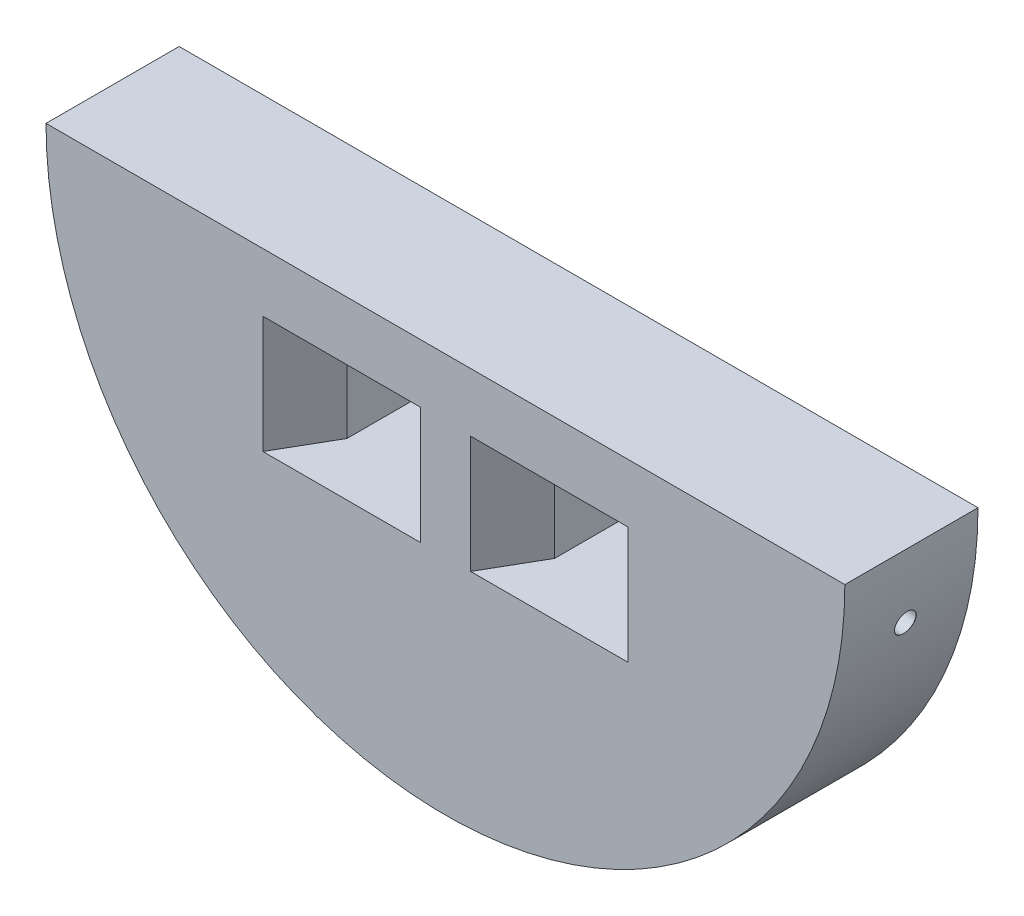
from build123d import *
from OCP.BRepFilletAPI import BRepFilletAPI_MakeChamfer

# Parameters (mm, degrees)
SKETCH1_W           = 18
SKETCH1_H           = 18
BOSS_EXTRUDE1_DEPTH = 25
CIRPATTERN1_COUNT   = 5
CIRPATTERN1_ANGLE   = 160
CHAMFER1_SIZE       = 15
CHAMFER1_SIZE2      = 8.660254038
CHAMFER3_SIZE       = 10
CHAMFER3_SIZE2      = 5.773502692
CHAMFER4_SIZE       = 4
CHAMFER4_SIZE2      = 6.92820323


with BuildPart() as part:
    # Sketch1 → Boss-Extrude1 (new body)
    with BuildSketch(Plane.XY):
        with BuildLine():
            Line((-150, 0), (0, 0))
            ThreePointArc((0, 0), (-75, -75), (-150, 0))
        make_face()
        with Locations((-55.5, -24)):
            Rectangle(SKETCH1_W, SKETCH1_H, mode=Mode.SUBTRACT)
        with Locations((-94.5, -24)):
            Rectangle(SKETCH1_W, SKETCH1_H, mode=Mode.SUBTRACT)
    extrude(amount=BOSS_EXTRUDE1_DEPTH)

    # Sketch4 → Ø4.0mm Dowel Hole2 (revolve, cut)
    with BuildSketch(Plane(origin=(-1.139418524, -13.023613325, 12.5), x_dir=(0.17364817766693047, 0.9848077530122081, 0), z_dir=(0, 0, 1))):
        Polygon((0, 0), (0, 17.201721238), (2, 16), (2, 0.025), (2.025, 0), align=None)
    f_4_0mm_dowel_hole2 = revolve(axis=Axis((5.114110708, -14.126279253, 12.5), (-0.9848077530122081, 0.17364817766693044, 0)), mode=Mode.SUBTRACT)

    # CirPattern1: Ø4.0mm Dowel Hole2 ×5 about axis
    cirpattern1_axis = Axis((-75, 0, 0), (0, 0, -1))
    for i in range(1, CIRPATTERN1_COUNT):
        add(f_4_0mm_dowel_hole2.rotate(cirpattern1_axis, i * CIRPATTERN1_ANGLE / (CIRPATTERN1_COUNT - 1)), mode=Mode.SUBTRACT)

    # Chamfer1: one chamfer whose edges measure the first distance from different faces: ONE call of the kernel's chamfer builder (chamfer() names one face for all edges)
    chamfer1_edges_1 = [part.edges().sort_by_distance(p)[0] for p in [
        (-55.5, -15, 0),
    ]]
    chamfer1_side_1 = [part.faces().sort_by_distance(p)[0] for p in [
        (-55.5, -15, 12.5),
    ]]
    chamfer1_edges_2 = [part.edges().sort_by_distance(p)[0] for p in [
        (-94.5, -15, 0),
    ]]
    chamfer1_side_2 = [part.faces().sort_by_distance(p)[0] for p in [
        (-94.5, -15, 12.5),
    ]]
    chamfer1 = BRepFilletAPI_MakeChamfer(part.part.solid().wrapped)
    for e in chamfer1_edges_1:
        chamfer1.Add(CHAMFER1_SIZE, CHAMFER1_SIZE2, e.wrapped, chamfer1_side_1[0].wrapped)  # the first distance lies on this face
    for e in chamfer1_edges_2:
        chamfer1.Add(CHAMFER1_SIZE, CHAMFER1_SIZE2, e.wrapped, chamfer1_side_2[0].wrapped)  # the first distance lies on this face
    add(Compound.cast(chamfer1.Shape()), mode=Mode.REPLACE)

    # Chamfer3: one chamfer whose edges measure the first distance from different faces: ONE call of the kernel's chamfer builder (chamfer() names one face for all edges)
    chamfer3_edges_1 = [part.edges().sort_by_distance(p)[0] for p in [
        (-103.5, -24, 25),
    ]]
    chamfer3_side_1 = [part.faces().sort_by_distance(p)[0] for p in [
        (-103.5, -22.500700474, 11.554010123),
    ]]
    chamfer3_edges_2 = [part.edges().sort_by_distance(p)[0] for p in [
        (-85.5, -24, 25),
    ]]
    chamfer3_side_2 = [part.faces().sort_by_distance(p)[0] for p in [
        (-85.5, -22.500700474, 11.554010123),
    ]]
    chamfer3_edges_3 = [part.edges().sort_by_distance(p)[0] for p in [
        (-46.5, -24, 25),
    ]]
    chamfer3_side_3 = [part.faces().sort_by_distance(p)[0] for p in [
        (-46.5, -22.500700474, 11.554010123),
    ]]
    chamfer3_edges_4 = [part.edges().sort_by_distance(p)[0] for p in [
        (-64.5, -24, 25),
    ]]
    chamfer3_side_4 = [part.faces().sort_by_distance(p)[0] for p in [
        (-64.5, -22.500700474, 11.554010123),
    ]]
    chamfer3 = BRepFilletAPI_MakeChamfer(part.part.solid().wrapped)
    for e in chamfer3_edges_1:
        chamfer3.Add(CHAMFER3_SIZE, CHAMFER3_SIZE2, e.wrapped, chamfer3_side_1[0].wrapped)  # the first distance lies on this face
    for e in chamfer3_edges_2:
        chamfer3.Add(CHAMFER3_SIZE, CHAMFER3_SIZE2, e.wrapped, chamfer3_side_2[0].wrapped)  # the first distance lies on this face
    for e in chamfer3_edges_3:
        chamfer3.Add(CHAMFER3_SIZE, CHAMFER3_SIZE2, e.wrapped, chamfer3_side_3[0].wrapped)  # the first distance lies on this face
    for e in chamfer3_edges_4:
        chamfer3.Add(CHAMFER3_SIZE, CHAMFER3_SIZE2, e.wrapped, chamfer3_side_4[0].wrapped)  # the first distance lies on this face
    add(Compound.cast(chamfer3.Shape()), mode=Mode.REPLACE)

    # Chamfer4
    chamfer4_edges = [part.edges().sort_by_distance(p)[0] for p in [
        (-55.5, -15, 25),
        (-94.5, -15, 25),
    ]]
    chamfer4_side = [part.faces().sort_by_distance(p)[0] for p in [
        (-75, -32.902748996, 25),
    ]]
    chamfer(chamfer4_edges, length=CHAMFER4_SIZE, length2=CHAMFER4_SIZE2, reference=chamfer4_side[0])


solid = part.part
